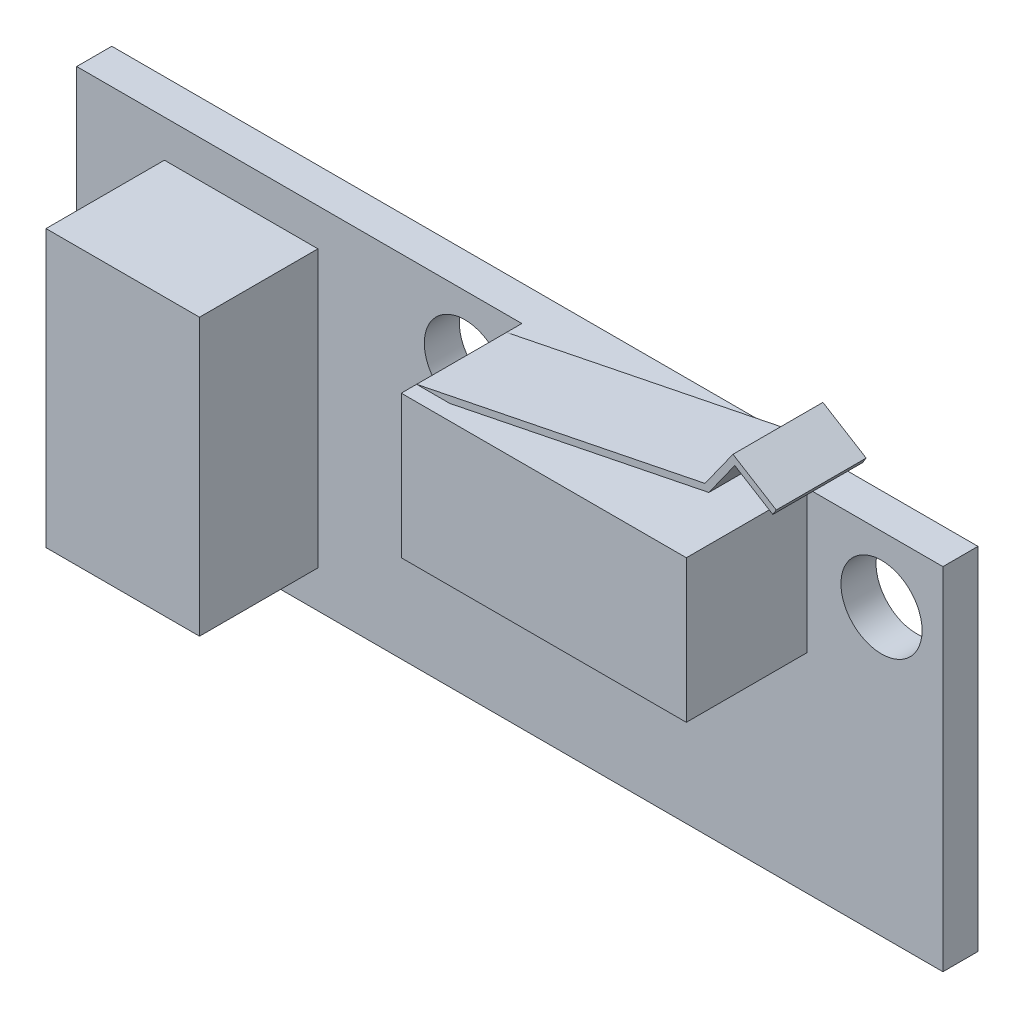
from build123d import *

# Parameters (mm, degrees)
SKETCH1_W           = 39.5
SKETCH1_H           = 16
BOSS_EXTRUDE1_DEPTH = 1.6
SKETCH2_R           = 1.85
CUT_EXTRUDE1_DEPTH  = 1.6
SKETCH3_W           = 13
SKETCH3_H           = 6.5
BOSS_EXTRUDE2_DEPTH = 5.5
BOSS_EXTRUDE3_DEPTH = 5.5
SKETCH5_W           = 19.265102418
SKETCH5_H           = 0.7
CUT_EXTRUDE2_DEPTH  = 14.5
SKETCH6_W           = 7
SKETCH6_H           = 12.6
BOSS_EXTRUDE4_DEPTH = 5.4


with BuildPart() as part:
    # Sketch1 → Boss-Extrude1 (new body)
    with BuildSketch(Plane.XY):
        Rectangle(SKETCH1_W, SKETCH1_H)
    extrude(amount=BOSS_EXTRUDE1_DEPTH)

    # Sketch2 → Cut-Extrude1 (cut)
    with BuildSketch(Plane.XY.offset(1.6)):
        with Locations((16.95, 5)):
            Circle(SKETCH2_R)
        with Locations((-2.05, 5)):
            Circle(SKETCH2_R)
    extrude(amount=-CUT_EXTRUDE1_DEPTH, mode=Mode.SUBTRACT)

    # Sketch3 → Boss-Extrude2 (add)
    with BuildSketch(Plane.XY.offset(1.6)):
        with Locations((7.05, 4.75)):
            Rectangle(SKETCH3_W, SKETCH3_H)
    extrude(amount=BOSS_EXTRUDE2_DEPTH)

    # Sketch4 → Boss-Extrude3 (add)
    with BuildSketch(Plane.XY.offset(7.1)):
        Polygon((0.55, 8), (13.700517382, 10.661205252), (14.977364281, 12.45), (16.95, 11.236411926), (16.792802867, 10.980894683), (15.058778515, 12.047686313), (13.875966055, 10.390628824), (2.062519543, 8), align=None)
    extrude(amount=-BOSS_EXTRUDE3_DEPTH)

    # Sketch5 → Cut-Extrude2 (cut)
    with BuildSketch(Plane(origin=(0, 8, 0), x_dir=(1, 0, 0), z_dir=(0, 1, 0))):
        with Locations((10.182551209, -6.75)):
            Rectangle(SKETCH5_W, SKETCH5_H)
        with Locations((10.182551209, -1.95)):
            Rectangle(SKETCH5_W, SKETCH5_H)
    extrude(amount=CUT_EXTRUDE2_DEPTH, mode=Mode.SUBTRACT)

    # Sketch6 → Boss-Extrude4 (add)
    with BuildSketch(Plane.XY.offset(1.6)):
        with Locations((-12.25, 0)):
            Rectangle(SKETCH6_W, SKETCH6_H)
    extrude(amount=BOSS_EXTRUDE4_DEPTH)


solid = part.part
